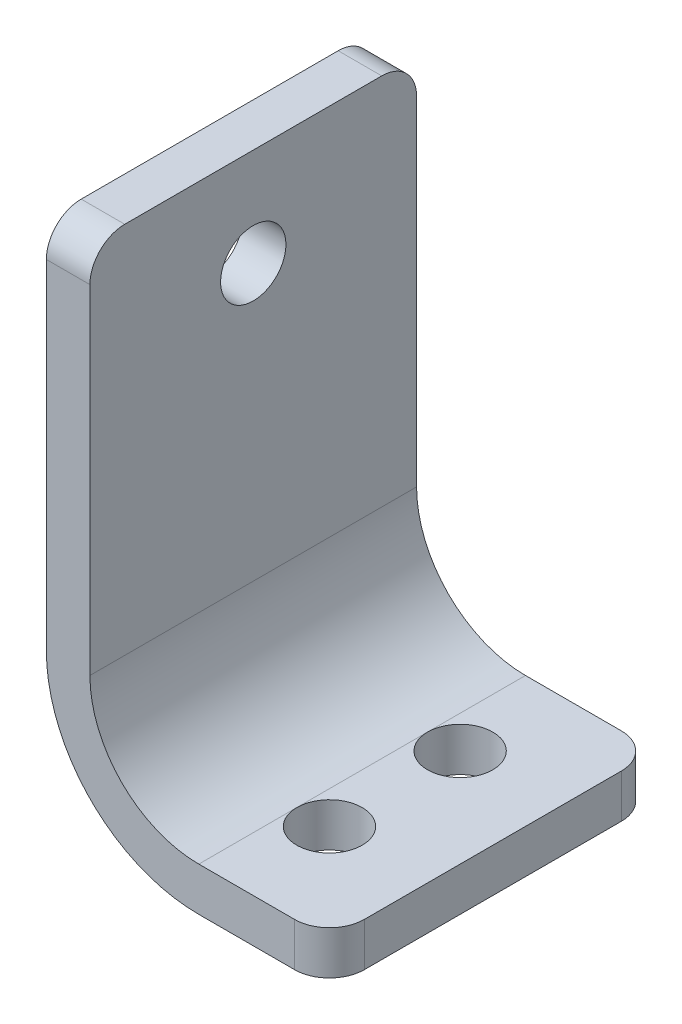
from build123d import *

# Parameters (mm, degrees)
BOSS_EXTRUDE1_DEPTH = 23.8125
SKETCH5_R           = 2.38125
CUT_EXTRUDE2_DEPTH  = 3.175
CUT_EXTRUDE3_REACH  = 47.909
SKETCH8_R           = 2.38125
FILLET1_R           = 2.54


with BuildPart() as part:
    # Sketch1 → Boss-Extrude1 (new body)
    with BuildSketch(Plane.XY):
        with BuildLine():
            Line((0, 19.99549417), (0, -7.21908183))
            ThreePointArc((0, -7.21908183), (2.324839924, -12.831741905), (7.9375, -15.15658183))
            Line((7.9375, -15.15658183), (17.4625, -15.15658183))
            Line((17.4625, -15.15658183), (17.4625, -18.33158183))
            Line((17.4625, -18.33158183), (7.9375, -18.33158183))
            ThreePointArc((7.9375, -18.33158183), (0.079775894, -15.076805936), (-3.175, -7.21908183))
            Line((-3.175, -7.21908183), (-3.175, 19.99549417))
            Line((-3.175, 19.99549417), (0, 19.99549417))
        make_face()
    extrude(amount=BOSS_EXTRUDE1_DEPTH)

    # Sketch5 → Cut-Extrude2 (cut)
    with BuildSketch(Plane.ZY.offset(3.175)):
        with Locations(Location((11.90625, 12.85174417, 0), (0, 0, 270))):
            Circle(SKETCH5_R)
    extrude(amount=-CUT_EXTRUDE2_DEPTH, mode=Mode.SUBTRACT)

    # Sketch8 → Cut-Extrude3 (cut, up to next)
    with BuildSketch(Plane(origin=(0, -15.15658183, 0), x_dir=(1, 0, 0), z_dir=(0, 1, 0)), mode=Mode.PRIVATE) as cut_extrude3_sk1:
        with Locations(Location((10.31875, -7.14375, 0), (0, 0, 180))):
            Circle(SKETCH8_R)
    cut_extrude3_tool1 = extrude(cut_extrude3_sk1.sketch, amount=-CUT_EXTRUDE3_REACH, mode=Mode.PRIVATE) & part.part
    # Sketch8 → Cut-Extrude3 (cut, up to next)
    with BuildSketch(Plane(origin=(0, -15.15658183, 0), x_dir=(1, 0, 0), z_dir=(0, 1, 0)), mode=Mode.PRIVATE) as cut_extrude3_sk2:
        with Locations(Location((10.31875, -16.66875, 0), (0, 0, 180))):
            Circle(SKETCH8_R)
    cut_extrude3_tool2 = extrude(cut_extrude3_sk2.sketch, amount=-CUT_EXTRUDE3_REACH, mode=Mode.PRIVATE) & part.part
    add(cut_extrude3_tool1.solids().sort_by_distance((10.31875, -15.156582, 7.14375))[0], mode=Mode.SUBTRACT)
    add(cut_extrude3_tool2.solids().sort_by_distance((10.31875, -15.156582, 16.66875))[0], mode=Mode.SUBTRACT)

    # Fillet1
    fillet1_edges = [part.edges().sort_by_distance(p)[0] for p in [
        (-1.5875, 19.99549417, 0),
        (17.4625, -16.74408183, 23.8125),
        (-1.5875, 19.99549417, 23.8125),
        (17.4625, -16.74408183, 0),
    ]]
    fillet(fillet1_edges, radius=FILLET1_R)


solid = part.part
